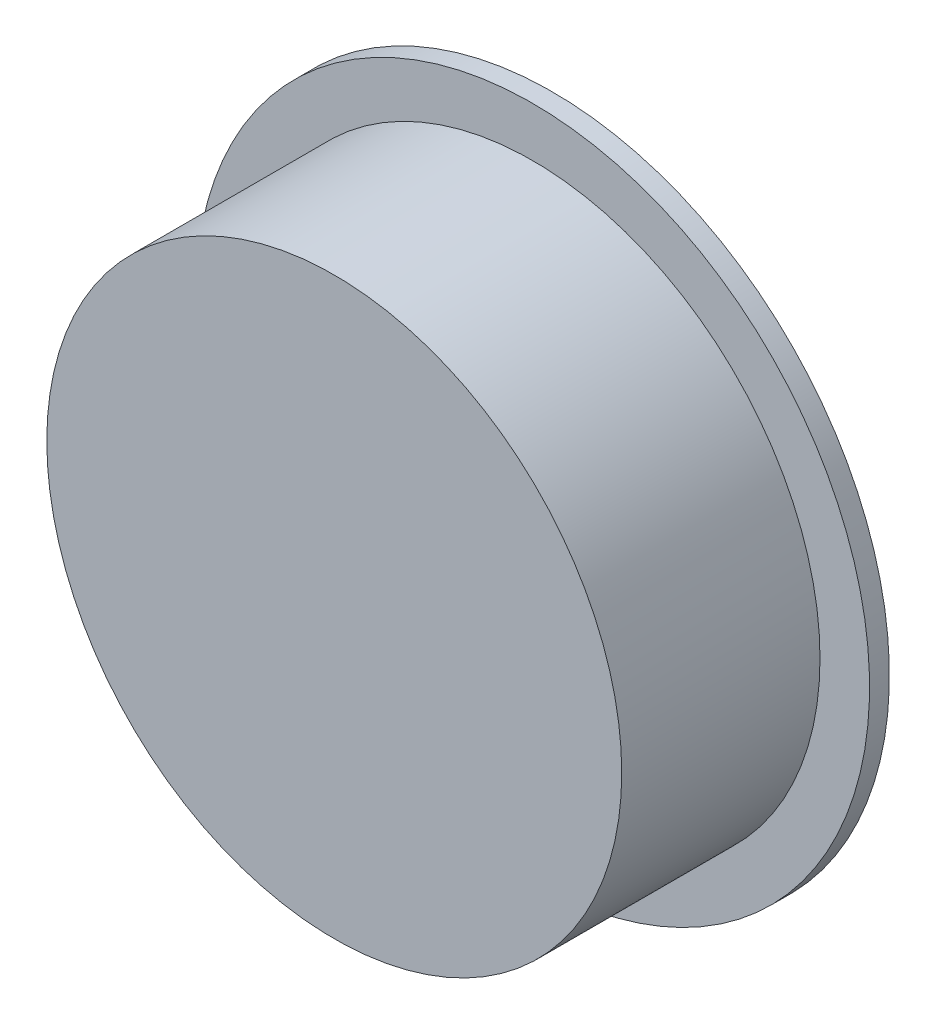
from build123d import *

# Parameters (mm, degrees)
SKETCH1_R           = 7.25
BOSS_EXTRUDE1_DEPTH = 5
SKETCH3_R           = 8.5
BOSS_EXTRUDE2_DEPTH = 0.5
SKETCH5_R           = 1.75
CUT_EXTRUDE1_DEPTH  = 0.75


with BuildPart() as part:
    # Sketch1 → Boss-Extrude1 (new body)
    with BuildSketch(Plane.XY):
        Circle(SKETCH1_R)
    extrude(amount=BOSS_EXTRUDE1_DEPTH)

    # Sketch3 → Boss-Extrude2 (add)
    with BuildSketch(Plane(origin=(0, 0, 0), x_dir=(-1, 0, 0), z_dir=(0, 0, -1))):
        Circle(SKETCH3_R)
    extrude(amount=BOSS_EXTRUDE2_DEPTH)

    # Sketch5 → Cut-Extrude1 (cut)
    with BuildSketch(Plane(origin=(0, 0, -0.5), x_dir=(-1, 0, 0), z_dir=(0, 0, -1))):
        Circle(SKETCH5_R)
    extrude(amount=-CUT_EXTRUDE1_DEPTH, mode=Mode.SUBTRACT)


solid = part.part
